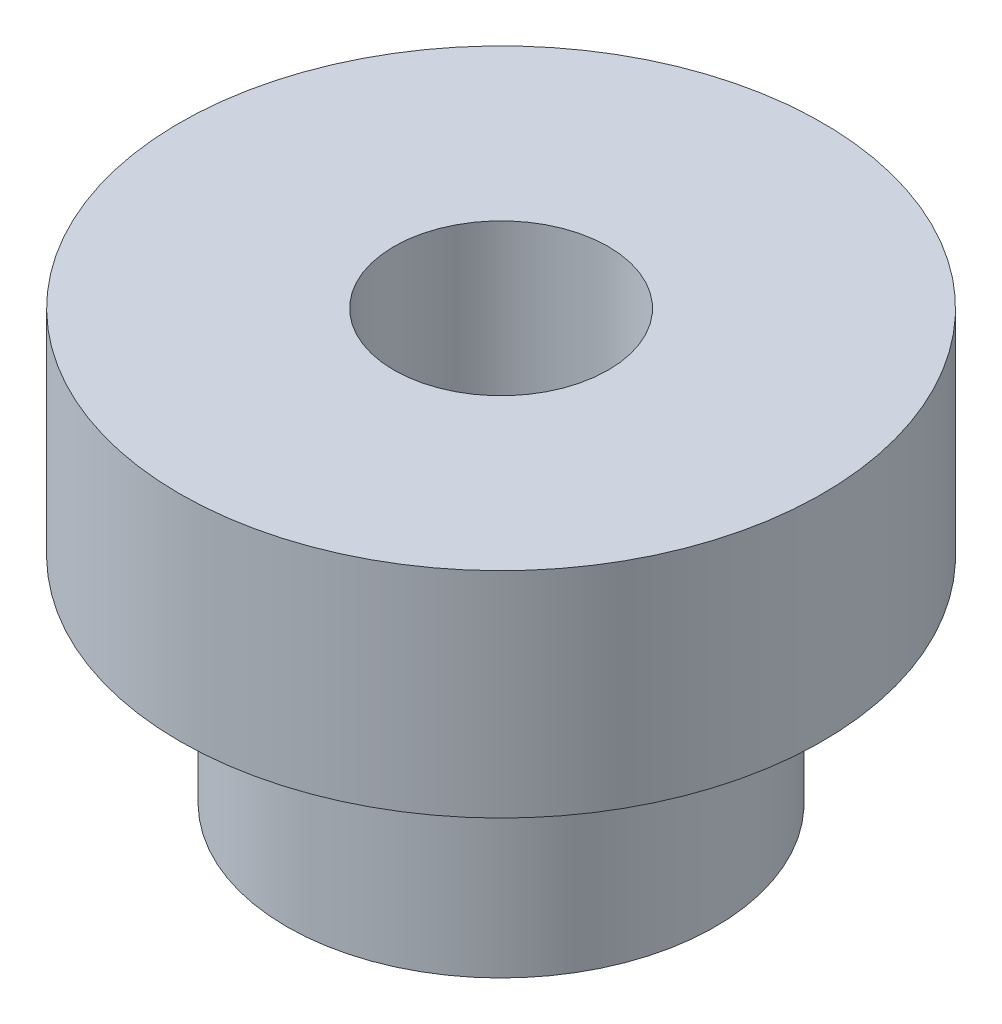
from build123d import *

# Parameters (mm, degrees)
SKETCH2_R           = 2
SKETCH2_R_2         = 1
BOSS_EXTRUDE1_DEPTH = 2
SKETCH3_R           = 3
SKETCH3_R_2         = 1
BOSS_EXTRUDE2_DEPTH = 2


with BuildPart() as part:
    # Sketch2 → Boss-Extrude1 (new body)
    with BuildSketch(Plane(origin=(0, 0, 0), x_dir=(1, 0, 0), z_dir=(0, 1, 0))):
        with Locations(Location((0, 0, 0), (0, 0, 270))):
            Circle(SKETCH2_R)
        with Locations(Location((0, 0, 0), (0, 0, 270))):
            Circle(SKETCH2_R_2, mode=Mode.SUBTRACT)
    extrude(amount=BOSS_EXTRUDE1_DEPTH)

    # Sketch3 → Boss-Extrude2 (add)
    with BuildSketch(Plane(origin=(0, 2, 0), x_dir=(1, 0, 0), z_dir=(0, 1, 0))):
        with Locations(Location((0, 0, 0), (0, 0, 270))):
            Circle(SKETCH3_R)
        with Locations(Location((0, 0, 0), (0, 0, 270))):
            Circle(SKETCH3_R_2, mode=Mode.SUBTRACT)
    extrude(amount=BOSS_EXTRUDE2_DEPTH)


solid = part.part
